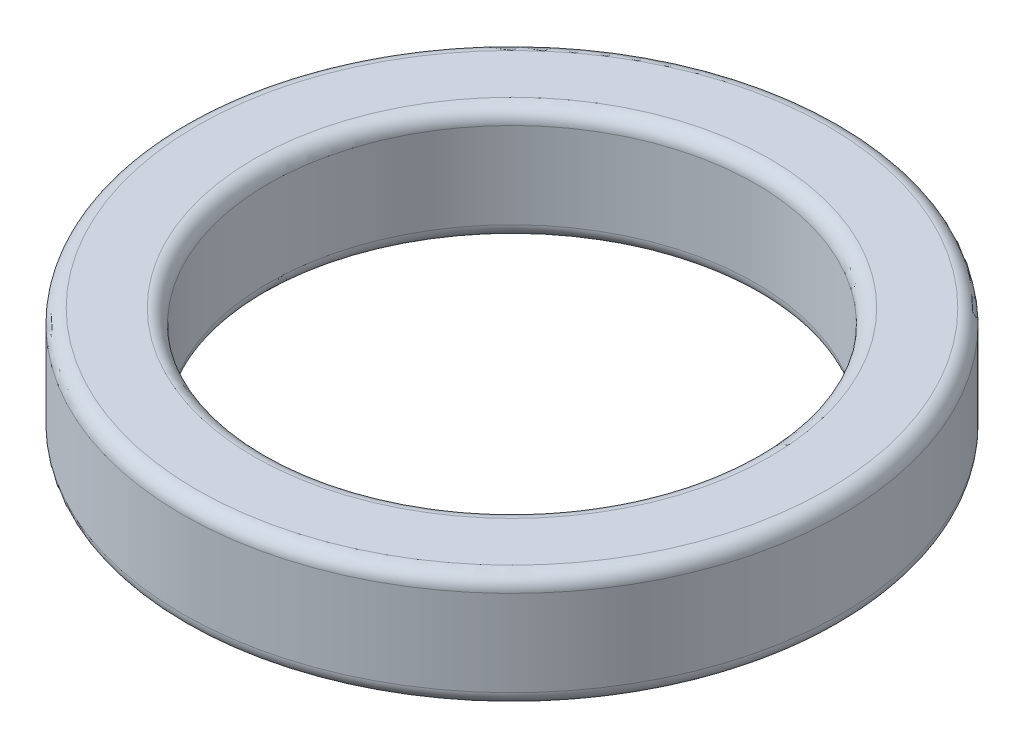
from build123d import *

# Parameters (mm, degrees)
SKIZZE1_R                       = 11.5
SKIZZE1_R_2                     = 8.5
AUFSATZ_LINEAR_AUSTRAGEN1_DEPTH = 4
VERRUNDUNG1_R                   = 0.5


with BuildPart() as part:
    # Skizze1 → Aufsatz-Linear austragen1 (new body)
    with BuildSketch(Plane(origin=(0, 0, 0), x_dir=(1, 0, 0), z_dir=(0, 1, 0))):
        with Locations(Location((0, 0, 0), (0, 0, 270))):
            Circle(SKIZZE1_R)
        with Locations(Location((0, 0, 0), (0, 0, 270))):
            Circle(SKIZZE1_R_2, mode=Mode.SUBTRACT)
    extrude(amount=AUFSATZ_LINEAR_AUSTRAGEN1_DEPTH)

    # Verrundung1
    verrundung1_edges = [part.edges().sort_by_distance(p)[0] for p in [
        (0, 0, -11.5),
        (0, 4, -11.5),
        (0, 0, -8.5),
        (0, 4, -8.5),
    ]]
    fillet(verrundung1_edges, radius=VERRUNDUNG1_R)


solid = part.part
